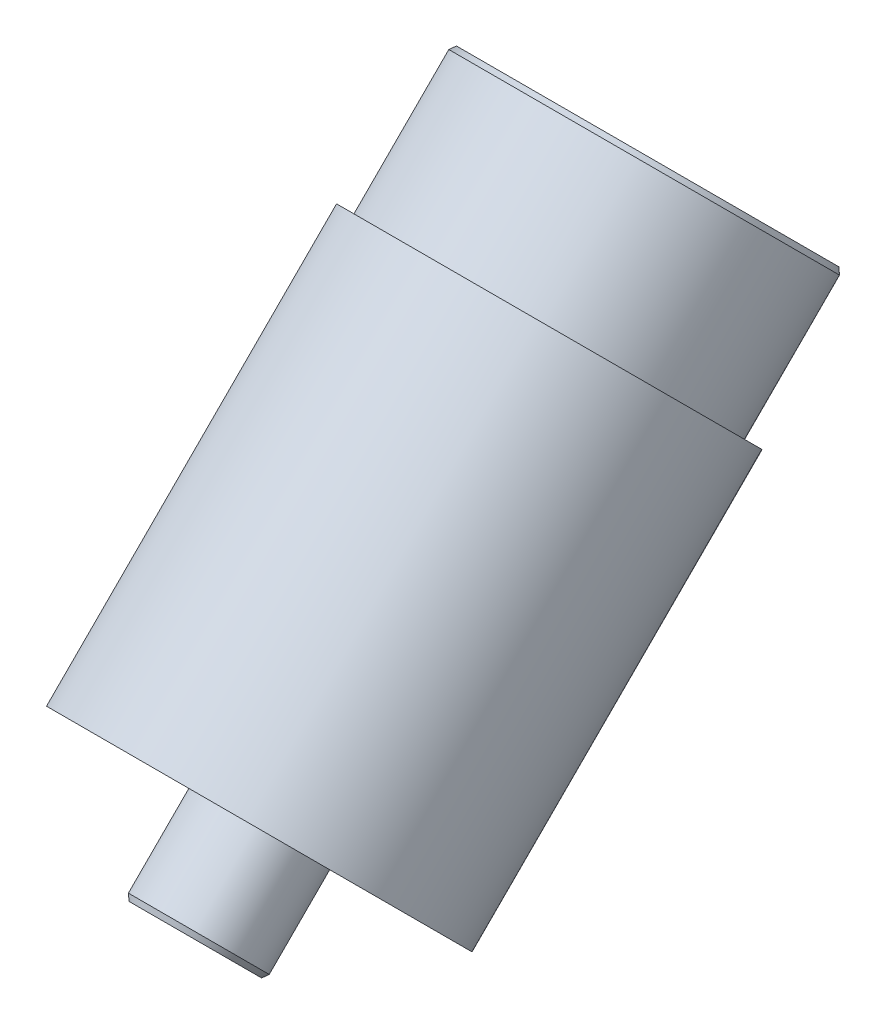
from build123d import *

# Parameters (mm, degrees)
BOSS_EXTRUDE7_DEPTH       = 9
BOSS_EXTRUDE7_DEPTH_BACK  = 50
SKETCH4_R                 = 25
SKETCH4_R_2               = 23
SKETCH20_R                = 8.275
BOSS_EXTRUDE16_DEPTH      = 13
SKETCH24_R                = 2.54
CUT_EXTRUDE10_DEPTH       = 4
SKETCH20_17_R             = 25
BOSS_EXTRUDE17_DEPTH      = 4
CUT_EXTRUDE9_DEPTH        = 30
CUT_EXTRUDE9_DEPTH_BACK   = 30
BOSS_EXTRUDE18_DEPTH      = 20
BOSS_EXTRUDE18_DEPTH_BACK = 15
SKETCH26_R                = 22.95
SKETCH26_R_2              = 21
BOSS_EXTRUDE19_START      = -15
SKETCH27_R                = 25
SKETCH27_R_2              = 21
BOSS_EXTRUDE19_DEPTH      = 15
CHAMFER1_SIZE             = 0.7
CHAMFER1_SIZE2            = 0.490145277
CHAMFER2_SIZE             = 0.7
CHAMFER2_SIZE2            = 0.490145277


with BuildPart() as part:
    # Sketch4 → Boss-Extrude7 (new, two sides: drawn at the far end of the back side and taken through both)
    with BuildSketch(Plane(origin=(0, -5.365491749, 5.365491749), x_dir=(-1, 0, 0), z_dir=(0, 0.7071067811865458, -0.7071067811865492)).offset(-BOSS_EXTRUDE7_DEPTH_BACK)):
        with Locations(Location((0, 0, 0), (0, 0, 90))):
            Circle(SKETCH4_R)
        with Locations(Location((0, 0, 0), (0, 0, 90))):
            Circle(SKETCH4_R_2, mode=Mode.SUBTRACT)
    extrude(amount=BOSS_EXTRUDE7_DEPTH + BOSS_EXTRUDE7_DEPTH_BACK)



with BuildPart() as body_2:
    # Sketch20 → Boss-Extrude16 (new body)
    with BuildSketch(Plane(origin=(0, -40.720830808, 40.720830808), x_dir=(1, 0, 0), z_dir=(0, -0.7071067811865457, 0.7071067811865495))):
        with Locations(Location((0, 0, 0), (0, 0, 270))):
            Circle(SKETCH20_R)
    extrude(amount=BOSS_EXTRUDE16_DEPTH)

    # Sketch24 → Cut-Extrude10 (cut)
    with BuildSketch(Plane(origin=(0, -49.913218964, 49.913218964), x_dir=(1, 0, 0), z_dir=(0, -0.7071067811865457, 0.7071067811865493))):
        with Locations(Location((0, 0, 0), (0, 0, 270))):
            Circle(SKETCH24_R)
    extrude(amount=-CUT_EXTRUDE10_DEPTH, mode=Mode.SUBTRACT)


with BuildPart() as part_1:
    add(part.part)

    add(body_2.part)  # Boss-Extrude17 merges body 2
    # Sketch20<17> → Boss-Extrude17 (add)
    with BuildSketch(Plane(origin=(0, -40.720830808, 40.720830808), x_dir=(1, 0, 0), z_dir=(0, -0.7071067811865457, 0.7071067811865495))):
        with Locations(Location((0, 0, 0), (0, 0, 90))):
            Circle(SKETCH20_17_R)
    extrude(amount=-BOSS_EXTRUDE17_DEPTH)

    # Sketch20<15> → Cut-Extrude9 (cut, two sides: drawn at the far end of the back side and taken through both)
    with BuildSketch(Plane(origin=(0, -40.720830808, 40.720830808), x_dir=(1, 0, 0), z_dir=(0, -0.7071067811865457, 0.7071067811865495)).offset(-CUT_EXTRUDE9_DEPTH_BACK)):
        with BuildLine():
            Line((-2.019900988, 1.54), (2.019900988, 1.54))
            ThreePointArc((2.019900988, 1.54), (2.54, 0), (2.019900988, -1.54))
            Line((2.019900988, -1.54), (-2.019900988, -1.54))
            ThreePointArc((-2.019900988, -1.54), (-2.54, 0), (-2.019900988, 1.54))
        make_face()
    extrude(amount=CUT_EXTRUDE9_DEPTH + CUT_EXTRUDE9_DEPTH_BACK, mode=Mode.SUBTRACT)



with BuildPart() as body_2_2:
    # Sketch26 → Boss-Extrude18 (new, two sides: drawn at the far end of the back side and taken through both)
    with BuildSketch(Plane(origin=(0, 0.998469282, -0.998469282), x_dir=(1, 0, 0), z_dir=(0, 0.7071067811865458, -0.7071067811865492)).offset(-BOSS_EXTRUDE18_DEPTH_BACK)):
        with Locations(Location((0, 0, 0), (0, 0, 270))):
            Circle(SKETCH26_R)
        with Locations(Location((0, 0, 0), (0, 0, 270))):
            Circle(SKETCH26_R_2, mode=Mode.SUBTRACT)
    extrude(amount=BOSS_EXTRUDE18_DEPTH + BOSS_EXTRUDE18_DEPTH_BACK)


with BuildPart() as part_2:
    add(part_1.part)

    add(body_2_2.part)  # Boss-Extrude19 merges body 2 2
    # Sketch27 → Boss-Extrude19 (add)
    with BuildSketch(Plane(origin=(0, 0.998469282, -0.998469282), x_dir=(1, 0, 0), z_dir=(0, 0.7071067811865458, -0.7071067811865492)).offset(BOSS_EXTRUDE19_START)):
        with Locations(Location((0, 0, 0), (0, 0, 270))):
            Circle(SKETCH27_R)
        with Locations(Location((0, 0, 0), (0, 0, 270))):
            Circle(SKETCH27_R_2, mode=Mode.SUBTRACT)
    extrude(amount=BOSS_EXTRUDE19_DEPTH)

    # Chamfer1
    chamfer1_edges = [part_2.edges().sort_by_distance(p)[0] for p in [
        (0, -1.087495723, -31.368705534),
    ]]
    chamfer1_side = [part_2.faces().sort_by_distance(p)[0] for p in [
        (0, -8.158563535, -24.297637722),
    ]]
    chamfer(chamfer1_edges, length=CHAMFER1_SIZE, length2=CHAMFER1_SIZE2, reference=chamfer1_side[0])

    # Chamfer2
    chamfer2_edges = [part_2.edges().sort_by_distance(p)[0] for p in [
        (0, -44.06191035, 55.764527578),
    ]]
    chamfer2_side = [part_2.faces().sort_by_distance(p)[0] for p in [
        (0, -39.465716272, 51.1683335),
    ]]
    chamfer(chamfer2_edges, length=CHAMFER2_SIZE, length2=CHAMFER2_SIZE2, reference=chamfer2_side[0])


solid = part_2.part
